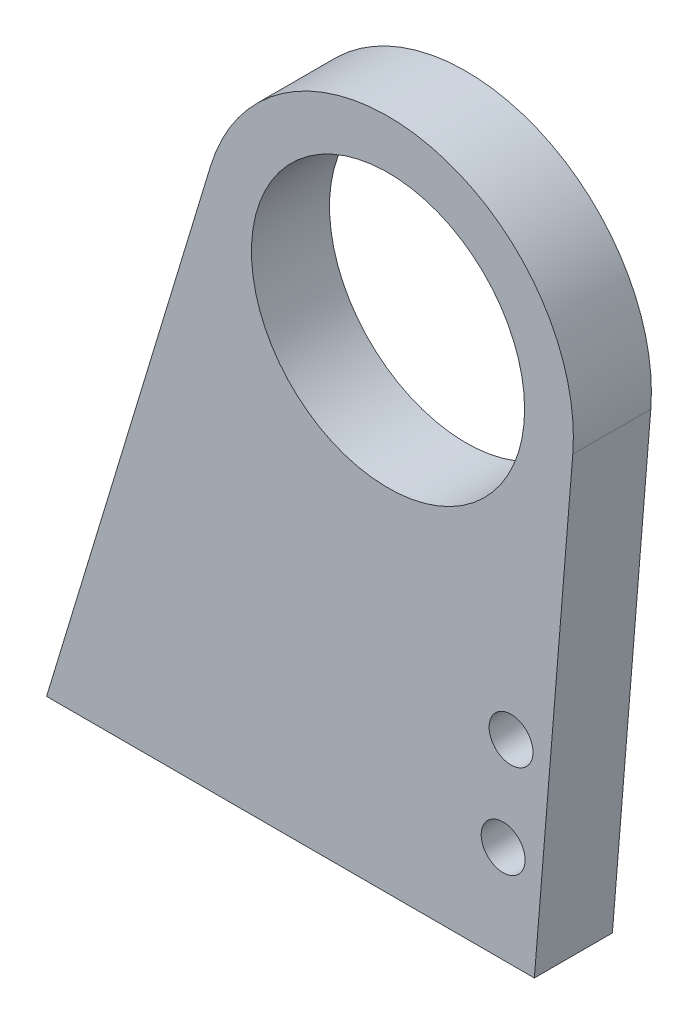
from build123d import *

# Parameters (mm, degrees)
SKETCH_1_R                   = 19
SKETCH_1_R_2                 = 14
EXTRUDE_1_DEPTH              = 8
HOLE_WIZARD_M4_1_D           = 4.5
HOLE_WIZARD_M3_1_D           = 2.5
HOLE_WIZARD_M3_1_DEPTH       = 8.5
HOLE_WIZARD_M3_1_CSINK_D     = 3.05
HOLE_WIZARD_M3_1_CSINK_ANGLE = 90
HOLE_WIZARD_M3_1_TIP         = 0.751075774


with BuildPart() as part:
    # 스케치1 → 보스-돌출1 (new body)
    # profile 1 of 2: a face of its own
    with BuildSketch(Plane.XY):
        with BuildLine():
            Line((16.816107383, 55.508724832), (0, 0))
            Line((0, 0), (50, 0))
            Line((50, 0), (53.937590447, 48.461277134))
            ThreePointArc((53.937590447, 48.461277134), (31.456182162, 31.333416083), (16.816107383, 55.508724832))
        make_face()
    # profile 2 of 2: a face of its own
    with BuildSketch(Plane.XY):
        with Locations((35, 50)):
            Circle(SKETCH_1_R)
        with Locations((35, 50)):
            Circle(SKETCH_1_R_2, mode=Mode.SUBTRACT)
    extrude(amount=EXTRUDE_1_DEPTH)

    # M4 여유 구멍1 (through all)
    with Locations(Plane.XY.offset(8)):
        with Locations((46.799340892, 10), (47.609195032, 19.967152867)):
            Hole(HOLE_WIZARD_M4_1_D / 2)

    # M3 나사 구멍1
    with Locations(Plane(origin=(0, 0, 0), x_dir=(-1, 0, 0), z_dir=(0, -1, 0))):
        with Locations((-10, -4), (-40, -4)):
            CounterSinkHole(HOLE_WIZARD_M3_1_D / 2, HOLE_WIZARD_M3_1_CSINK_D / 2, depth=HOLE_WIZARD_M3_1_DEPTH, counter_sink_angle=HOLE_WIZARD_M3_1_CSINK_ANGLE)
            with Locations((0, 0, -(HOLE_WIZARD_M3_1_DEPTH + HOLE_WIZARD_M3_1_TIP / 2))):  # 118° drill point
                Cone(0, HOLE_WIZARD_M3_1_D / 2, HOLE_WIZARD_M3_1_TIP, mode=Mode.SUBTRACT)


solid = part.part
